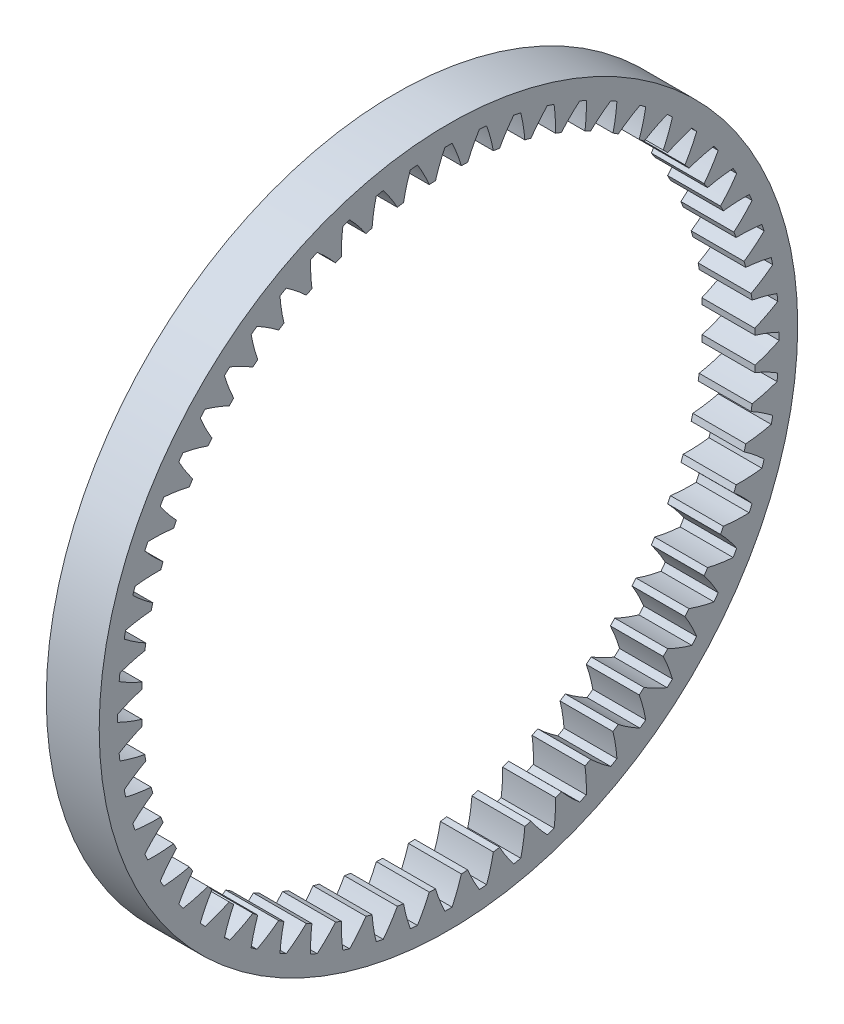
from build123d import *

# Parameters (mm, degrees)
BASPROSKE_W     = 5
BASPROSKE_H     = 4
TOOTHCUT_DEPTH  = 47.936126811
TEETHCUTS_COUNT = 60
TEETHCUTS_ANGLE = 354


with BuildPart() as part:
    # BasProSke → Base-Revolve (revolve)
    with BuildSketch(Plane(origin=(0, 0, 0), x_dir=(1, 0, 0), z_dir=(0, 1, 0)), mode=Mode.PRIVATE) as base_revolve_sk:
        with Locations((2.5, 31)):
            Rectangle(BASPROSKE_W, BASPROSKE_H)
    revolve(base_revolve_sk.sketch.rotate(Axis((-10, 0, 0), (1, 0, 0)), 180), axis=Axis((-10, 0, 0), (1, 0, 0)))

    # TooCutSke → ToothCut (cut, through all)
    with BuildSketch(Plane(origin=(0, 0, 0), x_dir=(0, 0, -1), z_dir=(1, 0, 0))):
        with BuildLine():
            ThreePointArc((1.227357706, 28.948593027), (0.830805794, 30.117149174), (0.339543276, 31.24915537))
            ThreePointArc((0.339543276, 31.24915537), (0, 31.251), (-0.339543276, 31.24915537))
            ThreePointArc((-0.339543276, 31.24915537), (-0.830805794, 30.117149174), (-1.227357706, 28.948593027))
            ThreePointArc((-1.227357706, 28.948593027), (0, 28.9746), (1.227357706, 28.948593027))
        make_face()
    toothcut = extrude(amount=TOOTHCUT_DEPTH, mode=Mode.SUBTRACT)

    # TeethCuts: ToothCut ×60 about axis
    teethcuts_axis = Axis((-10, 0, 0), (1, 0, 0))
    for i in range(1, TEETHCUTS_COUNT):
        add(toothcut.rotate(teethcuts_axis, i * TEETHCUTS_ANGLE / (TEETHCUTS_COUNT - 1)), mode=Mode.SUBTRACT)


solid = part.part
